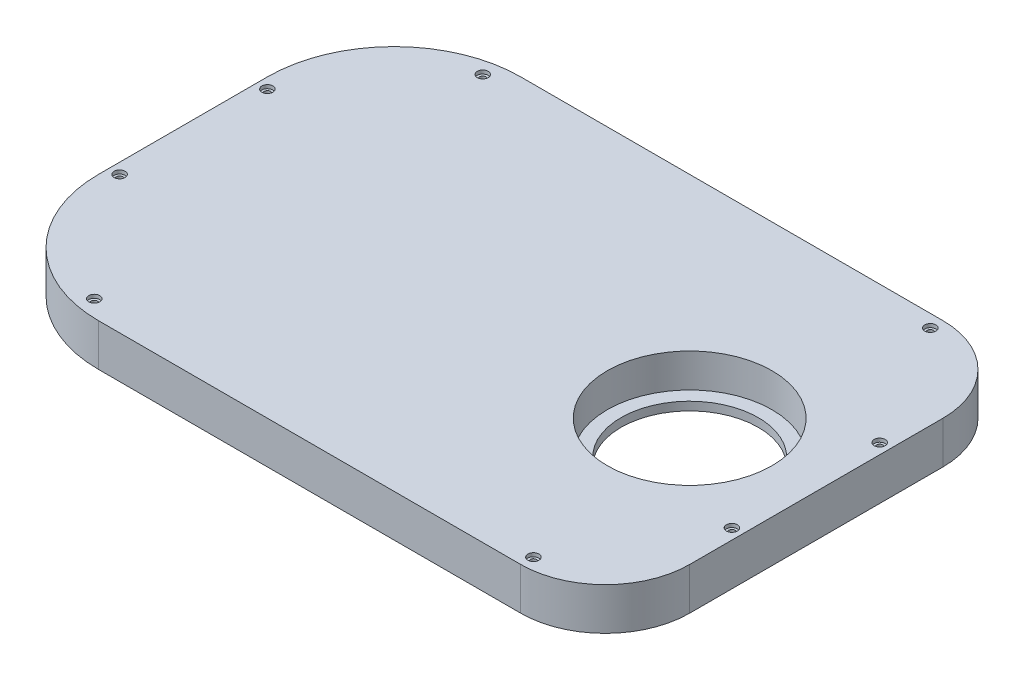
from build123d import *

# Parameters (mm, degrees)
SKETCH2_W                               = 300
SKETCH2_H                               = 200
BOSS_EXTRUDE1_DEPTH                     = 20
SKETCH3_W                               = 280
SKETCH3_H                               = 180
SKETCH3_W_2                             = 270
SKETCH3_H_2                             = 170
BOSS_EXTRUDE2_DEPTH                     = 10
FILLET1_R                               = 40
FILLET2_R                               = 60
SKETCH4_R                               = 39
CUT_EXTRUDE1_DEPTH                      = 16
SKETCH5_R                               = 32.5
CUT_EXTRUDE2_DEPTH                      = 16
SKETCH8_R                               = 1.5
CUT_EXTRUDE3_DEPTH                      = 20
CBORE_FOR_M5_HEX_HEAD_BOLT1_D           = 3
CBORE_FOR_M5_HEX_HEAD_BOLT1_DEPTH       = 20
CBORE_FOR_M5_HEX_HEAD_BOLT1_CBORE_D     = 5.2
CBORE_FOR_M5_HEX_HEAD_BOLT1_CBORE_DEPTH = 1.7
CBORE_FOR_M5_HEX_HEAD_BOLT1_TIP         = 0.901290929


with BuildPart() as part:
    # Sketch2 → Boss-Extrude1 (new body)
    with BuildSketch(Plane(origin=(0, 0, 0), x_dir=(1, 0, 0), z_dir=(0, 1, 0))):
        Rectangle(SKETCH2_W, SKETCH2_H)
    extrude(amount=BOSS_EXTRUDE1_DEPTH)

    # Sketch3 → Boss-Extrude2 (add)
    with BuildSketch(Plane.XZ):
        Rectangle(SKETCH3_W, SKETCH3_H)
        Rectangle(SKETCH3_W_2, SKETCH3_H_2, mode=Mode.SUBTRACT)
    extrude(amount=BOSS_EXTRUDE2_DEPTH)

    # Fillet1
    fillet1_edges = [part.edges().sort_by_distance(p)[0] for p in [
        (140, -5, -90),
        (140, -5, 90),
        (135, -5, -85),
        (135, -5, 85),
        (150, 10, -100),
        (150, 10, 100),
    ]]
    fillet(fillet1_edges, radius=FILLET1_R)

    # Fillet2
    fillet2_edges = [part.edges().sort_by_distance(p)[0] for p in [
        (-140, -5, 90),
        (-140, -5, -90),
        (-135, -5, -85),
        (-135, -5, 85),
        (-150, 10, -100),
        (-150, 10, 100),
    ]]
    fillet(fillet2_edges, radius=FILLET2_R)

    # Sketch4 → Cut-Extrude1 (cut)
    with BuildSketch(Plane(origin=(0, 20, 0), x_dir=(1, 0, 0), z_dir=(0, 1, 0))):
        with Locations(Location((90, 0, 0), (0, 0, 270))):
            Circle(SKETCH4_R)
    extrude(amount=-CUT_EXTRUDE1_DEPTH, mode=Mode.SUBTRACT)

    # Sketch5 → Cut-Extrude2 (cut)
    with BuildSketch(Plane(origin=(0, 4, 0), x_dir=(1, 0, 0), z_dir=(0, 1, 0))):
        with Locations(Location((90, 0, 0), (0, 0, 270))):
            Circle(SKETCH5_R)
    extrude(amount=-CUT_EXTRUDE2_DEPTH, mode=Mode.SUBTRACT)

    # Sketch8 → Cut-Extrude3 (cut)
    with BuildSketch(Plane.XZ):
        with Locations(Location((-100, 92, 0), (0, 0, 270))):
            Circle(SKETCH8_R)
        with Locations(Location((-100, -92, 0), (0, 0, 270))):
            Circle(SKETCH8_R)
        with Locations(Location((-145, 35, 0), (0, 0, 270))):
            Circle(SKETCH8_R)
        with Locations(Location((-145, -35, 0), (0, 0, 270))):
            Circle(SKETCH8_R)
        with Locations(Location((110, 94, 0), (0, 0, 270))):
            Circle(SKETCH8_R)
        with Locations(Location((110, -94, 0), (0, 0, 270))):
            Circle(SKETCH8_R)
        with Locations(Location((145, 35, 0), (0, 0, 270))):
            Circle(SKETCH8_R)
        with Locations(Location((145, -35, 0), (0, 0, 270))):
            Circle(SKETCH8_R)
    extrude(amount=-CUT_EXTRUDE3_DEPTH, mode=Mode.SUBTRACT)

    # CBORE for M5 Hex Head Bolt1
    with Locations(Plane(origin=(0, 20, 0), x_dir=(1, 0, 0), z_dir=(0, 1, 0))):
        with Locations((110, 94), (145, 35), (145, -35), (110, -94), (-100, -92), (-145, -35), (-145, 35), (-100, 92)):
            CounterBoreHole(CBORE_FOR_M5_HEX_HEAD_BOLT1_D / 2, CBORE_FOR_M5_HEX_HEAD_BOLT1_CBORE_D / 2, CBORE_FOR_M5_HEX_HEAD_BOLT1_CBORE_DEPTH, depth=CBORE_FOR_M5_HEX_HEAD_BOLT1_DEPTH)
            with Locations((0, 0, -(CBORE_FOR_M5_HEX_HEAD_BOLT1_DEPTH + CBORE_FOR_M5_HEX_HEAD_BOLT1_TIP / 2))):  # 118° drill point
                Cone(0, CBORE_FOR_M5_HEX_HEAD_BOLT1_D / 2, CBORE_FOR_M5_HEX_HEAD_BOLT1_TIP, mode=Mode.SUBTRACT)


solid = part.part
